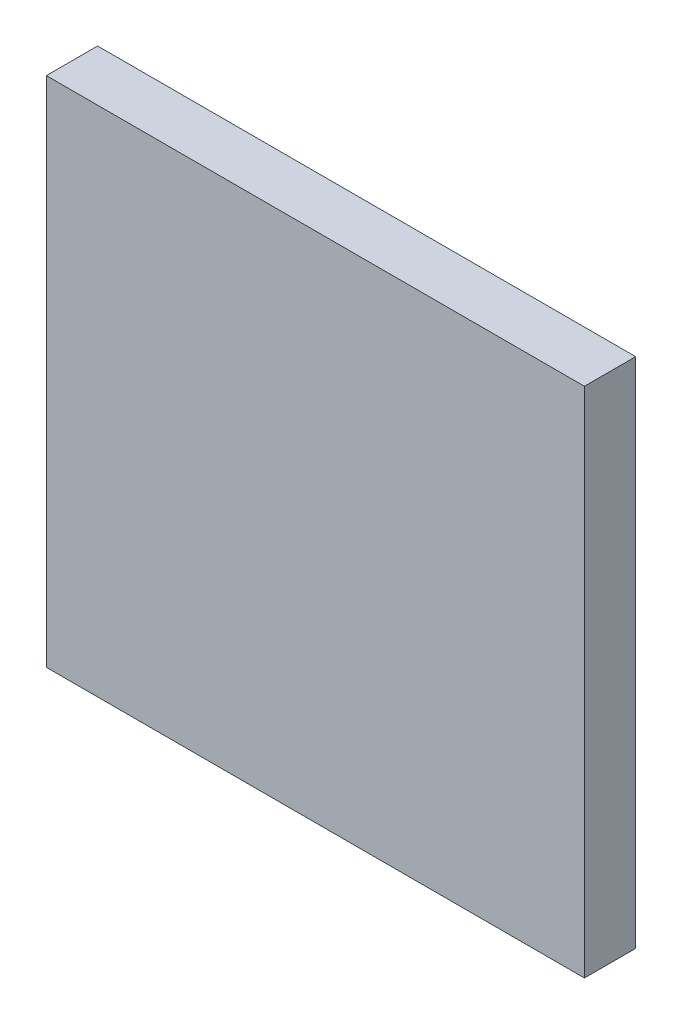
from build123d import *

# Parameters (mm, degrees)
SKETCH_1_W      = 1050
SKETCH_1_H      = 1000
EXTRUDE_1_DEPTH = 100


with BuildPart() as part:
    # Эскиз1 → Бобышка-Вытянуть1 (new body)
    with BuildSketch(Plane.XY):
        with Locations((525, -500)):
            Rectangle(SKETCH_1_W, SKETCH_1_H)
    extrude(amount=EXTRUDE_1_DEPTH)


solid = part.part
